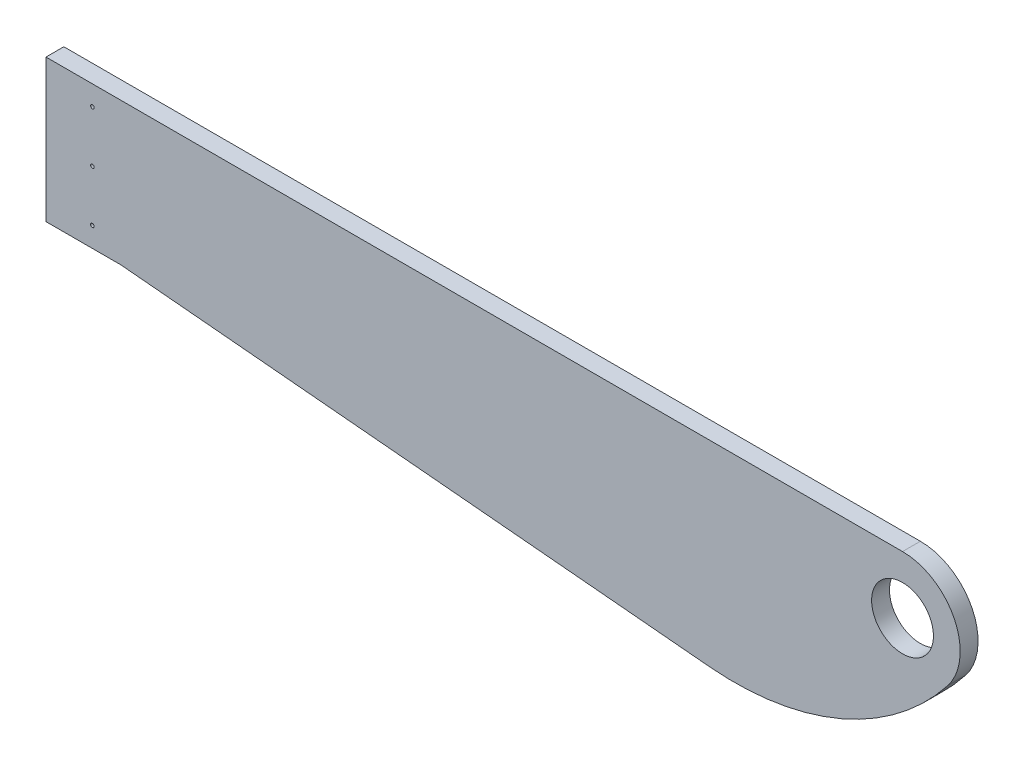
from build123d import *

# Parameters (mm, degrees)
SKETCH1_R               = 11
BOSS_EXTRUDE1_DEPTH     = 6.35
CUT_EXTRUDE1_DEPTH      = 383.821165724
CUT_EXTRUDE1_DEPTH_BACK = 383.821165724
SKETCH2_R               = 0.635


with BuildPart() as part:
    # Sketch1 → Boss-Extrude1 (new body)
    with BuildSketch(Plane.XY):
        with BuildLine():
            Line((54.2, -30.213113696), (80.87, -30.213113696))
            Line((80.87, -30.213113696), (290.352370469, -49.325))
            ThreePointArc((290.352370469, -49.325), (337.438235998, -41.792944501), (375.172105998, -12.638774172))
            ThreePointArc((375.172105998, -12.638774172), (377.448393763, 8.996243247), (359, 20.525))
            Line((359, 20.525), (54.2, 20.525))
            Line((54.2, 20.525), (54.2, -30.213113696))
        make_face()
        with Locations((359, 0)):
            Circle(SKETCH1_R, mode=Mode.SUBTRACT)
    extrude(amount=BOSS_EXTRUDE1_DEPTH)

    # Sketch2 → Cut-Extrude1 (cut, two sides: drawn at the far end of the back side and taken through both)
    with BuildSketch(Plane(origin=(0, 0, 0), x_dir=(-1, 0, 0), z_dir=(0, 0, -1)).offset(-CUT_EXTRUDE1_DEPTH_BACK)):
        with Locations((-70.71, -23.132056848)):
            Circle(SKETCH2_R)
        with Locations((-70.71, -4.844056848)):
            Circle(SKETCH2_R)
        with Locations((-70.71, 13.443943152)):
            Circle(SKETCH2_R)
    extrude(amount=CUT_EXTRUDE1_DEPTH + CUT_EXTRUDE1_DEPTH_BACK, mode=Mode.SUBTRACT)


solid = part.part
